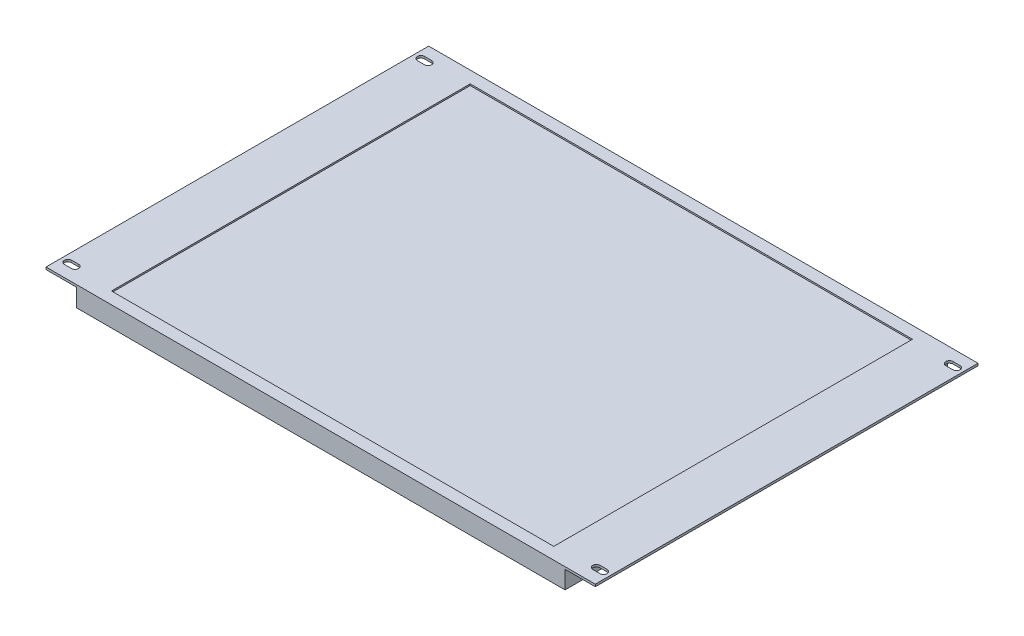
from build123d import *

# Parameters (mm, degrees)
SKETCH1_W           = 327
SKETCH1_H           = 256
BOSS_EXTRUDE1_DEPTH = 13.462
SKETCH2_W           = 20.25
SKETCH2_H           = 256
BOSS_EXTRUDE2_DEPTH = 1.5
SKETCH3_W           = 295.90708001
SKETCH3_H           = 240
CUT_EXTRUDE1_DEPTH  = 1
SKETCH4_W           = 140
SKETCH4_H           = 60
SKETCH4_W_2         = 120
SKETCH4_H_2         = 30
SKETCH4_W_3         = 104
SKETCH4_H_3         = 23
BOSS_EXTRUDE4_DEPTH = 20
CUT_EXTRUDE2_DEPTH  = 227.423867876


with BuildPart() as part:
    # Sketch1 → Boss-Extrude1 (new body)
    with BuildSketch(Plane(origin=(0, 0, 0), x_dir=(1, 0, 0), z_dir=(0, 1, 0))):
        Rectangle(SKETCH1_W, SKETCH1_H)
    extrude(amount=BOSS_EXTRUDE1_DEPTH)

    # Sketch2 → Boss-Extrude2 (add)
    with BuildSketch(Plane.XZ.offset(-13.462)):
        with Locations((173.625, 0)):
            Rectangle(SKETCH2_W, SKETCH2_H)
        with Locations((-173.625, 0)):
            Rectangle(SKETCH2_W, SKETCH2_H)
    extrude(amount=BOSS_EXTRUDE2_DEPTH)

    # Sketch3 → Cut-Extrude1 (cut)
    with BuildSketch(Plane(origin=(0, 13.462, 0), x_dir=(1, 0, 0), z_dir=(0, 1, 0))):
        Rectangle(SKETCH3_W, SKETCH3_H)
    extrude(amount=-CUT_EXTRUDE1_DEPTH, mode=Mode.SUBTRACT)

    # Sketch4 → Boss-Extrude4 (add)
    with BuildSketch(Plane.XZ):
        with Locations((-73.5, -53)):
            Rectangle(SKETCH4_W, SKETCH4_H)
        with Locations((73.5, -19)):
            Rectangle(SKETCH4_W_2, SKETCH4_H_2)
        with Locations((75.5, -66.5)):
            Rectangle(SKETCH4_W_3, SKETCH4_H_3)
    extrude(amount=BOSS_EXTRUDE4_DEPTH)

    # Sketch5 → Cut-Extrude2 (cut, through all)
    with BuildSketch(Plane(origin=(0, 13.462, 0), x_dir=(1, 0, 0), z_dir=(0, 1, 0))):
        with BuildLine():
            Line((174.375, 120.65), (179.125, 120.65))
            ThreePointArc((179.125, 120.65), (181.55, 118.225), (179.125, 115.8))
            Line((179.125, 115.8), (174.375, 115.8))
            ThreePointArc((174.375, 115.8), (171.95, 118.225), (174.375, 120.65))
        make_face()
        with BuildLine():
            Line((-179.125, 120.65), (-174.375, 120.65))
            ThreePointArc((-174.375, 120.65), (-171.95, 118.225), (-174.375, 115.8))
            Line((-174.375, 115.8), (-179.125, 115.8))
            ThreePointArc((-179.125, 115.8), (-181.55, 118.225), (-179.125, 120.65))
        make_face()
        with BuildLine():
            Line((-179.125, -115.5), (-174.375, -115.5))
            ThreePointArc((-174.375, -115.5), (-171.95, -117.925), (-174.375, -120.35))
            Line((-174.375, -120.35), (-179.125, -120.35))
            ThreePointArc((-179.125, -120.35), (-181.55, -117.925), (-179.125, -115.5))
        make_face()
        with BuildLine():
            Line((174.375, -115.5), (179.125, -115.5))
            ThreePointArc((179.125, -115.5), (181.55, -117.925), (179.125, -120.35))
            Line((179.125, -120.35), (174.375, -120.35))
            ThreePointArc((174.375, -120.35), (171.95, -117.925), (174.375, -115.5))
        make_face()
    extrude(amount=-CUT_EXTRUDE2_DEPTH, mode=Mode.SUBTRACT)


solid = part.part
